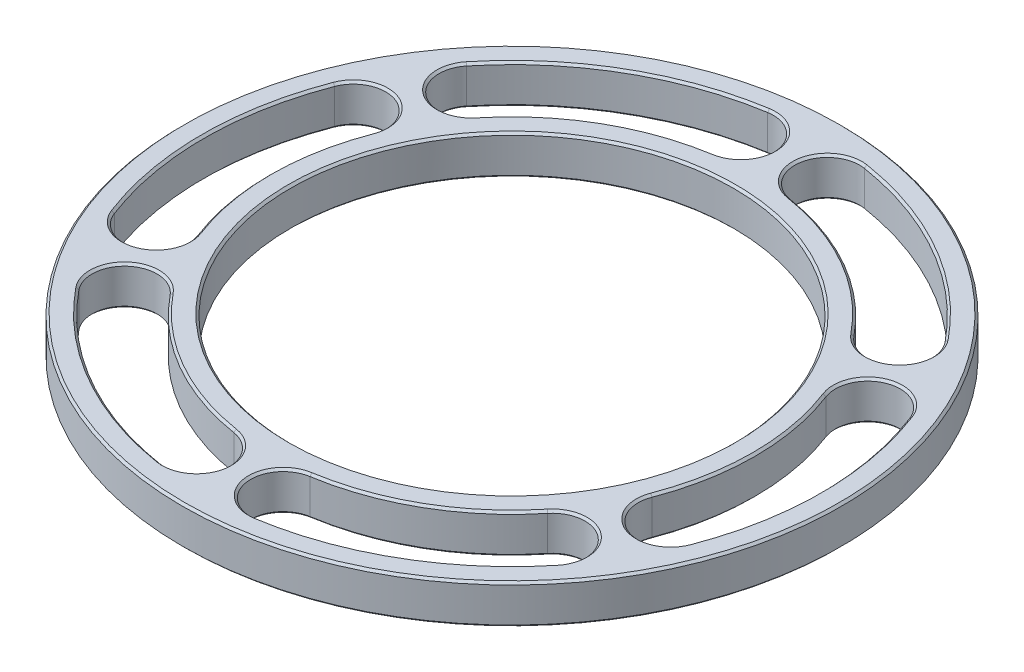
from build123d import *

# Parameters (mm, degrees)
SKETCH1_W                    = 24.97495
SKETCH1_H                    = 9
CUT_EXTRUDE1_DEPTH           = 10
CHAMFER3_SIZE                = 0.5
CHAMFER4_SIZE                = 0.5
CIRPATTERN1_COUNT            = 6
CHAMFER4_OF_CIRPATTERN1_SIZE = 0.5


with BuildPart() as part:
    # Sketch1 → Revolve1 (revolve)
    with BuildSketch(Plane.XY, mode=Mode.PRIVATE) as revolve1_sk:
        with Locations((63.612525, 4.5)):
            Rectangle(SKETCH1_W, SKETCH1_H)
    revolve(revolve1_sk.sketch.rotate(Axis((0, 0, 0), (0, 1, 0)), 90), axis=Axis((0, 0, 0), (0, 1, 0)))

    # Sketch2 → Cut-Extrude1 (cut)
    with BuildSketch(Plane(origin=(0, 9, 0), x_dir=(1, 0, 0), z_dir=(0, 1, 0))):
        with BuildLine():
            ThreePointArc((-66.392272497, 25.441622447), (-71.1, 0), (-66.392272497, -25.441622447))
            ThreePointArc((-66.392272497, -25.441622447), (-56.721330267, -29.754097391), (-52.408855323, -20.083155161))
            ThreePointArc((-52.408855323, -20.083155161), (-56.12505, 0), (-52.408855323, 20.083155161))
            ThreePointArc((-52.408855323, 20.083155161), (-56.721330267, 29.754097391), (-66.392272497, 25.441622447))
        make_face()
    cut_extrude1 = extrude(amount=-CUT_EXTRUDE1_DEPTH, mode=Mode.SUBTRACT)

    # Chamfer3
    chamfer3_edges = [part.edges().sort_by_distance(p)[0] for p in [
        (0, 0, 76.1),
        (0, 9, 76.1),
        (0, 9, 51.12505),
        (0, 0, 51.12505),
    ]]
    chamfer(chamfer3_edges, length=CHAMFER3_SIZE)

    # Chamfer4
    chamfer4_edges = [part.edges().sort_by_distance(p)[0] for p in [
        (-71.1, 0, 0),
        (-56.721330267, 0, -29.754097391),
        (-56.721330267, 0, 29.754097391),
        (-56.12505, 0, 0),
        (-56.12505, 9, 0),
        (-71.1, 9, 0),
        (-56.721330267, 9, 29.754097391),
        (-56.721330267, 9, -29.754097391),
    ]]
    chamfer(chamfer4_edges, length=CHAMFER4_SIZE)

    # CirPattern1: Cut-Extrude1 ×6 about axis
    cirpattern1_axis = Axis((0, 0, 0), (0, 1, 0))
    for i in range(1, CIRPATTERN1_COUNT):
        add(cut_extrude1.rotate(cirpattern1_axis, i * 360 / CIRPATTERN1_COUNT), mode=Mode.SUBTRACT)

    # Chamfer4 of CirPattern1
    chamfer4_of_cirpattern1_edges = [part.edges().sort_by_distance(p)[0] for p in [
        (-35.55, 0, 61.574406209),
        (-54.12846934, 0, 34.245064252),
        (-2.592860926, 0, 63.999161643),
        (-28.062525, 0, 48.605719089),
        (-28.062525, 9, 48.605719089),
        (-35.55, 9, 61.574406209),
        (-2.592860926, 9, 63.999161643),
        (-54.12846934, 9, 34.245064252),
        (35.55, 0, 61.574406209),
        (2.592860926, 0, 63.999161643),
        (54.12846934, 0, 34.245064252),
        (28.062525, 0, 48.605719089),
        (28.062525, 9, 48.605719089),
        (35.55, 9, 61.574406209),
        (54.12846934, 9, 34.245064252),
        (2.592860926, 9, 63.999161643),
        (71.1, 0, 0),
        (56.721330267, 0, 29.754097391),
        (56.721330267, 0, -29.754097391),
        (56.12505, 0, 0),
        (56.12505, 9, 0),
        (71.1, 9, 0),
        (56.721330267, 9, -29.754097391),
        (56.721330267, 9, 29.754097391),
        (35.55, 0, -61.574406209),
        (54.12846934, 0, -34.245064252),
        (2.592860926, 0, -63.999161643),
        (28.062525, 0, -48.605719089),
        (28.062525, 9, -48.605719089),
        (35.55, 9, -61.574406209),
        (2.592860926, 9, -63.999161643),
        (54.12846934, 9, -34.245064252),
        (-35.55, 0, -61.574406209),
        (-2.592860926, 0, -63.999161643),
        (-54.12846934, 0, -34.245064252),
        (-28.062525, 0, -48.605719089),
        (-28.062525, 9, -48.605719089),
        (-35.55, 9, -61.574406209),
        (-54.12846934, 9, -34.245064252),
        (-2.592860926, 9, -63.999161643),
    ]]
    chamfer(chamfer4_of_cirpattern1_edges, length=CHAMFER4_OF_CIRPATTERN1_SIZE)


solid = part.part
